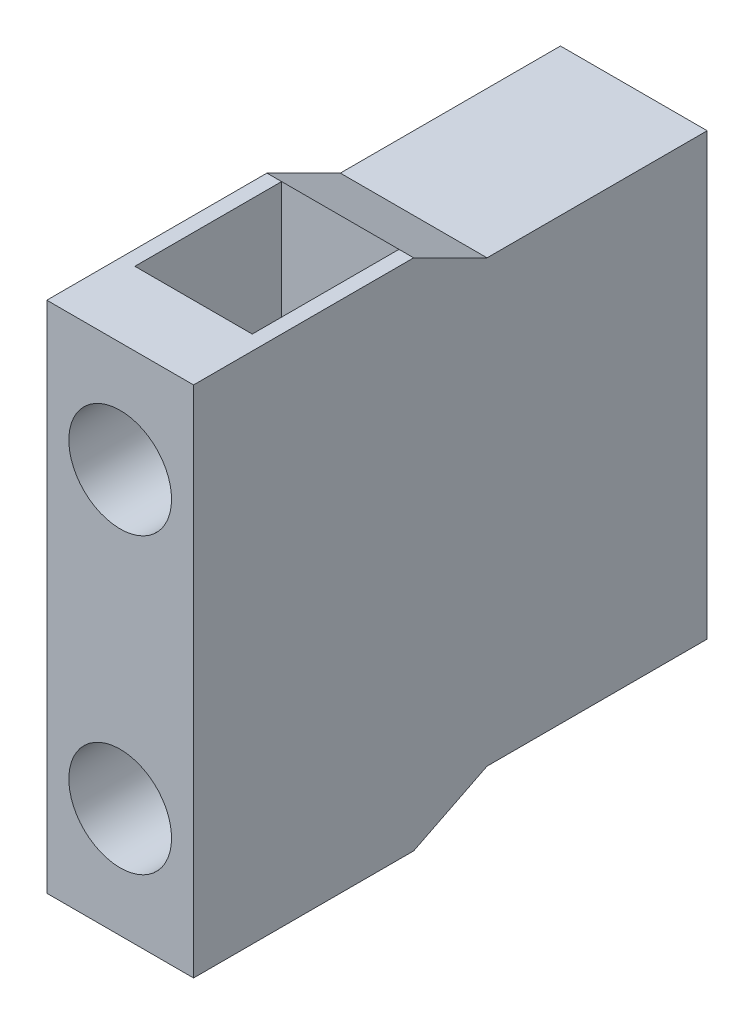
from build123d import *

# Parameters (mm, degrees)
SKETCH1_W           = 15
SKETCH1_H           = 30
BOSS_EXTRUDE1_DEPTH = 10
SKETCH2_R           = 3.5
CUT_EXTRUDE1_DEPTH  = 15
SKETCH3_W           = 8
SKETCH3_H           = 10
CUT_EXTRUDE2_DEPTH  = 35
SKETCH4_W           = 10
SKETCH4_H           = 5
BOSS_EXTRUDE2_DEPTH = 35


with BuildPart() as part:
    # Sketch1 → Boss-Extrude1 (new body)
    with BuildSketch(Plane(origin=(0, 0, 0), x_dir=(0, 0, -1), z_dir=(1, 0, 0))):
        with Locations((27.5, 17.5)):
            Rectangle(SKETCH1_W, SKETCH1_H)
        Polygon((20, 2.5), (20, 32.5), (15, 35), (0, 35), (0, 0), (15, 0), align=None)
    extrude(amount=BOSS_EXTRUDE1_DEPTH)

    # Sketch2 → Cut-Extrude1 (cut)
    with BuildSketch(Plane.XY):
        with Locations((5, 27.5)):
            Circle(SKETCH2_R)
        with Locations((5, 7.5)):
            Circle(SKETCH2_R)
    extrude(amount=-CUT_EXTRUDE1_DEPTH, mode=Mode.SUBTRACT)

    # Sketch3 → Cut-Extrude2 (cut)
    with BuildSketch(Plane(origin=(0, 35, 0), x_dir=(1, 0, 0), z_dir=(0, 1, 0))):
        with Locations((5, 10)):
            Rectangle(SKETCH3_W, SKETCH3_H)
    extrude(amount=-CUT_EXTRUDE2_DEPTH, mode=Mode.SUBTRACT)

    # Sketch4 → Boss-Extrude2 (add)
    with BuildSketch(Plane.XY):
        with Locations((5, 17.5)):
            Rectangle(SKETCH4_W, SKETCH4_H)
    extrude(amount=-BOSS_EXTRUDE2_DEPTH)


solid = part.part
